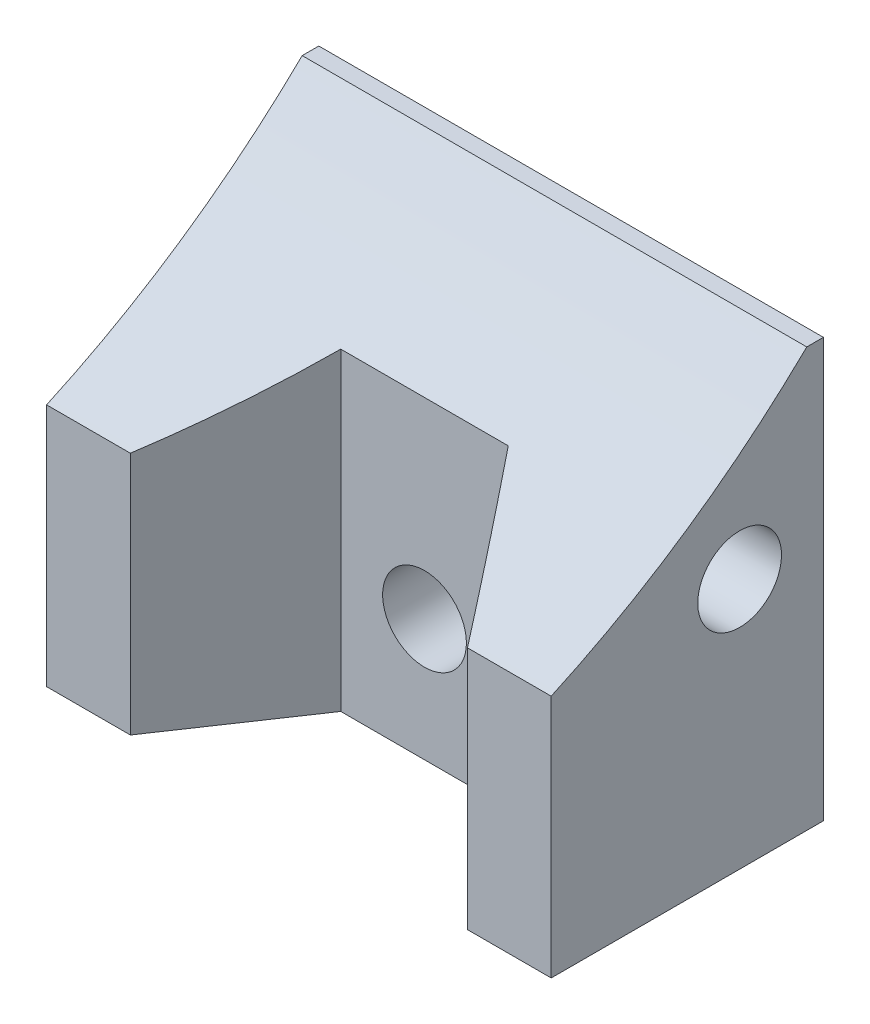
from build123d import *

# Parameters (mm, degrees)
SKETCH_1_W          = 24.1
SKETCH_1_H          = 20
EXTRUDE_1_DEPTH     = 13
CUT_EXTRUDE_2_DEPTH = 30.151500819
SKETCH_4_R          = 2
CUT_EXTRUDE_3_DEPTH = 21.351965507
CUT_EXTRUDE_4_DEPTH = 27.724567349
SKETCH_6_R          = 2
CUT_EXTRUDE_5_DEPTH = 30.151500819


with BuildPart() as part:
    # 草图1 → 凸台-拉伸1 (new body)
    with BuildSketch(Plane.XY):
        Rectangle(SKETCH_1_W, SKETCH_1_H)
    extrude(amount=EXTRUDE_1_DEPTH)

    # 草图3 → 切除-拉伸2 (cut, through all)
    with BuildSketch(Plane(origin=(12.05, 0, 0), x_dir=(0, 0, -1), z_dir=(1, 0, 0))):
        with BuildLine():
            Line((-0.7940006, 10), (-13, 10))
            Line((-13, 10), (-13, 1.657184567))
            ThreePointArc((-13, 1.657184567), (-6.535745695, 5.300056859), (-0.7940006, 10))
        make_face()
    extrude(amount=-CUT_EXTRUDE_2_DEPTH, mode=Mode.SUBTRACT)

    # 草图4 → 切除-拉伸3 (cut, through all)
    with BuildSketch(Plane.XY.offset(13)):
        with Locations((0, -4.171407716)):
            Circle(SKETCH_4_R)
    extrude(amount=-CUT_EXTRUDE_3_DEPTH, mode=Mode.SUBTRACT)

    # 草图5 → 切除-拉伸4 (cut, through all)
    with BuildSketch(Plane.XZ.offset(10)):
        Polygon((0, 13), (-8.05, 13), (-4, 7), (0, 7), align=None)
        Polygon((8.05, 13), (0, 13), (0, 7), (4, 7), align=None)
    extrude(amount=-CUT_EXTRUDE_4_DEPTH, mode=Mode.SUBTRACT)

    # 草图6 → 切除-拉伸5 (cut, through all)
    with BuildSketch(Plane(origin=(12.05, 0, 0), x_dir=(0, 0, -1), z_dir=(1, 0, 0))):
        with Locations(Location((-4, 2, 0), (0, 0, 90))):
            Circle(SKETCH_6_R)
    extrude(amount=-CUT_EXTRUDE_5_DEPTH, mode=Mode.SUBTRACT)


solid = part.part
